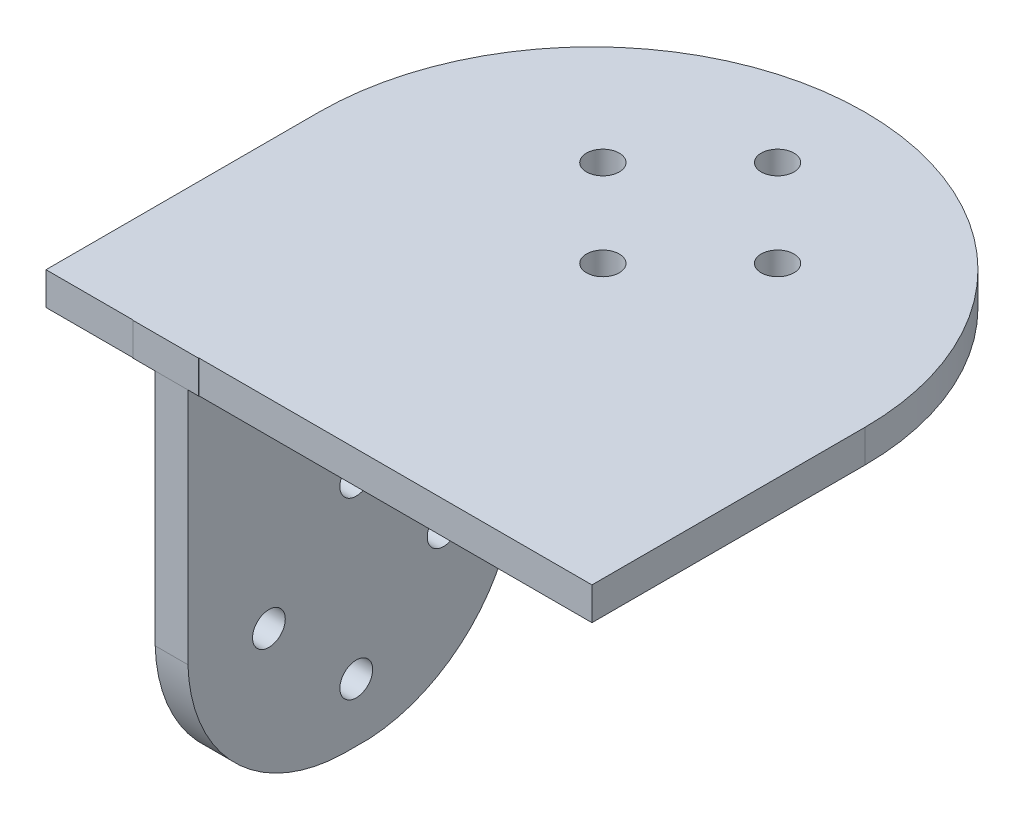
from build123d import *

# Parameters (mm, degrees)
BOSS_EXTRU_1_DEPTH      = 3
ESQUISSE4_W             = 4
ESQUISSE4_H             = 25
ENL_V_MAT_EXTRU_1_DEPTH = 3
ESQUISSE5_R             = 1.5
ENL_V_MAT_EXTRU_2_DEPTH = 3
ESQUISSE9_W             = 25.088970056
ESQUISSE9_H             = 3
BOSS_EXTRU_5_DEPTH      = 6
ESQUISSE10_W            = 3
ESQUISSE10_H            = 30
BOSS_EXTRU_6_DEPTH      = 36
ESQUISSE12_R            = 1.5
ENL_V_MAT_EXTRU_3_DEPTH = 36
ESQUISSE8_W             = 25.033293463
ESQUISSE8_H             = 3
BOSS_EXTRU_4_DEPTH      = 6


with BuildPart() as part:
    # Esquisse2 → Boss.-Extru.1 (new body)
    with BuildSketch(Plane(origin=(0, 0, 0), x_dir=(1, 0, 0), z_dir=(0, 1, 0))):
        with BuildLine():
            Line((-25, 0), (-25, -25))
            Line((-25, -25), (25, -25))
            Line((25, -25), (25, 0))
            ThreePointArc((25, 0), (0, 25), (-25, 0))
        make_face()
    extrude(amount=BOSS_EXTRU_1_DEPTH)

    # Esquisse4 → Enlèv. mat.-Extru.1 (cut)
    with BuildSketch(Plane.XZ):
        with Locations((-13, 12.5)):
            Rectangle(ESQUISSE4_W, ESQUISSE4_H)
    extrude(amount=-ENL_V_MAT_EXTRU_1_DEPTH, mode=Mode.SUBTRACT)

    # Esquisse5 → Enlèv. mat.-Extru.2 (cut)
    with BuildSketch(Plane.XZ):
        with Locations(Location((8, -9, 0), (0, 0, 270))):
            Circle(ESQUISSE5_R)
        with Locations(Location((-8, -9, 0), (0, 0, 270))):
            Circle(ESQUISSE5_R)
        with Locations(Location((0, -17, 0), (0, 0, 270))):
            Circle(ESQUISSE5_R)
        with Locations(Location((0, -1, 0), (0, 0, 270))):
            Circle(ESQUISSE5_R)
    extrude(amount=-ENL_V_MAT_EXTRU_2_DEPTH, mode=Mode.SUBTRACT)

    # Esquisse9 → Boss.-Extru.5 (add)
    with BuildSketch(Plane(origin=(-15, 0, 0), x_dir=(0, 0, -1), z_dir=(1, 0, 0))):
        with Locations((-12.455514972, 1.5)):
            Rectangle(ESQUISSE9_W, ESQUISSE9_H)
    extrude(amount=BOSS_EXTRU_5_DEPTH)

    # Esquisse10 → Boss.-Extru.6 (add)
    with BuildSketch(Plane.XZ):
        with Locations((-13.5, 10)):
            Rectangle(ESQUISSE10_W, ESQUISSE10_H)
    extrude(amount=BOSS_EXTRU_6_DEPTH)

    # Esquisse12 → Enlèv. mat.-Extru.3 (cut)
    with BuildSketch(Plane(origin=(-12, 0, 0), x_dir=(0, 0, 1), z_dir=(1, 0, 0))):
        with BuildLine():
            Line((-5, 36), (-5, 22.662353219))
            ThreePointArc((-5, 22.662353219), (-0.867271737, 31.867271737), (8.337646782, 36))
            Line((8.337646782, 36), (-5, 36))
        make_face()
        with BuildLine():
            Line((25, 36), (10.831176607, 36))
            ThreePointArc((10.831176607, 36), (20.732510765, 31.732510766), (25, 21.831176609))
            Line((25, 21.831176609), (25, 36))
        make_face()
        with Locations(Location((9.585618663, 30.662353219, 0), (0, 0, 180))):
            Circle(ESQUISSE12_R)
        with Locations(Location((1.585618663, 22.662353219, 0), (0, 0, 180))):
            Circle(ESQUISSE12_R)
        with Locations(Location((9.585618663, 14.662353219, 0), (0, 0, 180))):
            Circle(ESQUISSE12_R)
        with Locations(Location((17.585618663, 22.662353219, 0), (0, 0, 180))):
            Circle(ESQUISSE12_R)
    extrude(amount=-ENL_V_MAT_EXTRU_3_DEPTH, mode=Mode.SUBTRACT)

    # Esquisse8 → Boss.-Extru.4 (add)
    with BuildSketch(Plane.ZY.offset(11)):
        with Locations((12.516646732, 1.5)):
            Rectangle(ESQUISSE8_W, ESQUISSE8_H)
    extrude(amount=BOSS_EXTRU_4_DEPTH)


solid = part.part
